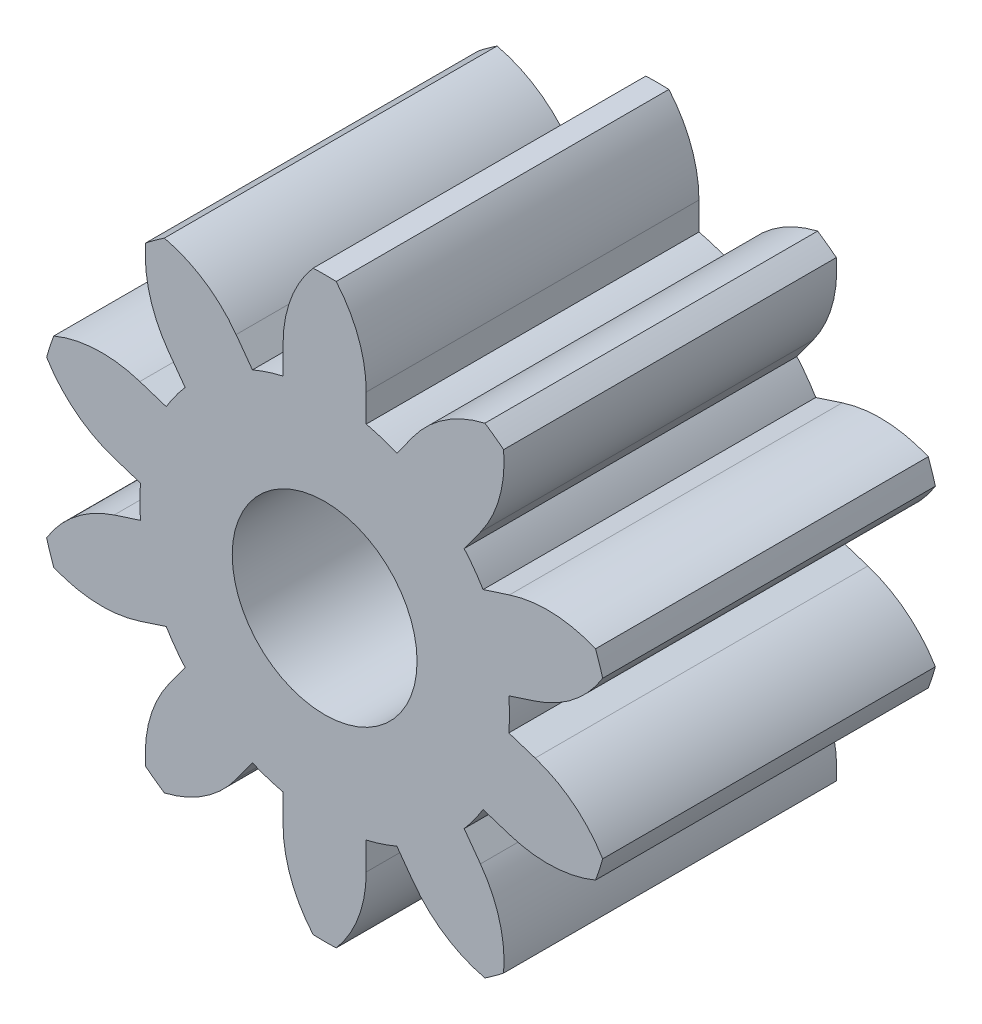
from build123d import *

# Parameters (mm, degrees)
ESBO_O1_R                = 2
RESSALTO_EXTRUS_O1_DEPTH = 3.6
CORTE_EXTRUS_O1_REACH    = 7.637
ESBO_O2_R                = 1


with BuildPart() as part:
    # Esboço1 → Ressalto-extrusão1 (new body)
    with BuildSketch(Plane.XY):
        Circle(ESBO_O1_R)
        with BuildLine():
            Line((-1.99959981, -1.122867364), (-1.714282855, -1.030162265))
            ThreePointArc((-1.714282855, -1.030162265), (-1.902113033, -0.618033989), (-1.99239815, -0.174211401))
            Line((-1.99239815, -0.174211401), (-2.277715105, -0.266916499))
            ThreePointArc((-2.277715105, -0.266916499), (-2.695113044, -0.490735084), (-3.008300145, -0.846023191))
            ThreePointArc((-3.008300145, -0.846023191), (-2.972051613, -0.965678107), (-2.931045896, -1.08378732))
            ThreePointArc((-2.931045896, -1.08378732), (-2.4688391, -1.187134677), (-1.99959981, -1.122867364))
        make_face()
        with BuildLine():
            Line((-2.277715105, 0.266916499), (-1.99239815, 0.174211401))
            ThreePointArc((-1.99239815, 0.174211401), (-1.902113033, 0.618033989), (-1.714282855, 1.030162265))
            Line((-1.714282855, 1.030162265), (-1.99959981, 1.122867364))
            ThreePointArc((-1.99959981, 1.122867364), (-2.4688391, 1.187134677), (-2.931045896, 1.08378732))
            ThreePointArc((-2.931045896, 1.08378732), (-2.972051613, 0.965678107), (-3.008300145, 0.846023191))
            ThreePointArc((-3.008300145, 0.846023191), (-2.695113044, 0.490735084), (-2.277715105, 0.266916499))
        make_face()
        with BuildLine():
            Line((-1.685820646, 1.554747331), (-1.509485071, 1.312042233))
            ThreePointArc((-1.509485071, 1.312042233), (-1.175570505, 1.618033989), (-0.781369776, 1.84104896))
            Line((-0.781369776, 1.84104896), (-0.957705351, 2.083754058))
            ThreePointArc((-0.957705351, 2.083754058), (-1.299552532, 2.411559342), (-1.734231738, 2.599627912))
            ThreePointArc((-1.734231738, 2.599627912), (-1.836828913, 2.528178107), (-1.936485986, 2.452681599))
            ThreePointArc((-1.936485986, 2.452681599), (-1.891945409, 1.981160724), (-1.685820646, 1.554747331))
        make_face()
        with BuildLine():
            Line((-0.45, 2.248717527), (-0.45, 1.948717527))
            ThreePointArc((-0.45, 1.948717527), (0, 2), (0.45, 1.948717527))
            Line((0.45, 1.948717527), (0.45, 2.248717527))
            ThreePointArc((0.45, 2.248717527), (0.366118933, 2.714850303), (0.125, 3.122498999))
            ThreePointArc((0.125, 3.122498999), (0, 3.125), (-0.125, 3.122498999))
            ThreePointArc((-0.125, 3.122498999), (-0.366118933, 2.714850303), (-0.45, 2.248717527))
        make_face()
        with BuildLine():
            ThreePointArc((0.781369776, 1.84104896), (1.175570505, 1.618033989), (1.509485071, 1.312042233))
            Line((1.509485071, 1.312042233), (1.685820646, 1.554747331))
            ThreePointArc((1.685820646, 1.554747331), (1.891945409, 1.981160724), (1.936485986, 2.452681599))
            ThreePointArc((1.936485986, 2.452681599), (1.836828913, 2.528178107), (1.734231738, 2.599627912))
            ThreePointArc((1.734231738, 2.599627912), (1.299552532, 2.411559342), (0.957705351, 2.083754058))
            Line((0.957705351, 2.083754058), (0.781369776, 1.84104896))
        make_face()
        with BuildLine():
            ThreePointArc((1.714282855, 1.030162265), (1.902113033, 0.618033989), (1.99239815, 0.174211401))
            Line((1.99239815, 0.174211401), (2.277715105, 0.266916499))
            ThreePointArc((2.277715105, 0.266916499), (2.695113044, 0.490735084), (3.008300145, 0.846023191))
            ThreePointArc((3.008300145, 0.846023191), (2.972051613, 0.965678107), (2.931045896, 1.08378732))
            ThreePointArc((2.931045896, 1.08378732), (2.4688391, 1.187134677), (1.99959981, 1.122867364))
            Line((1.99959981, 1.122867364), (1.714282855, 1.030162265))
        make_face()
        with BuildLine():
            ThreePointArc((1.99239815, -0.174211401), (1.902113033, -0.618033989), (1.714282855, -1.030162265))
            Line((1.714282855, -1.030162265), (1.99959981, -1.122867364))
            ThreePointArc((1.99959981, -1.122867364), (2.4688391, -1.187134677), (2.931045896, -1.08378732))
            ThreePointArc((2.931045896, -1.08378732), (2.972051613, -0.965678107), (3.008300145, -0.846023191))
            ThreePointArc((3.008300145, -0.846023191), (2.695113044, -0.490735084), (2.277715105, -0.266916499))
            Line((2.277715105, -0.266916499), (1.99239815, -0.174211401))
        make_face()
        with BuildLine():
            ThreePointArc((1.509485071, -1.312042233), (1.175570505, -1.618033989), (0.781369776, -1.84104896))
            Line((0.781369776, -1.84104896), (0.957705351, -2.083754058))
            ThreePointArc((0.957705351, -2.083754058), (1.299552532, -2.411559342), (1.734231738, -2.599627912))
            ThreePointArc((1.734231738, -2.599627912), (1.836828913, -2.528178107), (1.936485986, -2.452681599))
            ThreePointArc((1.936485986, -2.452681599), (1.891945409, -1.981160724), (1.685820646, -1.554747331))
            Line((1.685820646, -1.554747331), (1.509485071, -1.312042233))
        make_face()
        with BuildLine():
            Line((-0.45, -1.948717527), (-0.45, -2.248717527))
            ThreePointArc((-0.45, -2.248717527), (-0.366118933, -2.714850303), (-0.125, -3.122498999))
            ThreePointArc((-0.125, -3.122498999), (0, -3.125), (0.125, -3.122498999))
            ThreePointArc((0.125, -3.122498999), (0.366118933, -2.714850303), (0.45, -2.248717527))
            Line((0.45, -2.248717527), (0.45, -1.948717527))
            ThreePointArc((0.45, -1.948717527), (0, -2), (-0.45, -1.948717527))
        make_face()
        with BuildLine():
            Line((-0.957705351, -2.083754058), (-0.781369776, -1.84104896))
            ThreePointArc((-0.781369776, -1.84104896), (-1.175570505, -1.618033989), (-1.509485071, -1.312042233))
            Line((-1.509485071, -1.312042233), (-1.685820646, -1.554747331))
            ThreePointArc((-1.685820646, -1.554747331), (-1.891945409, -1.981160724), (-1.936485986, -2.452681599))
            ThreePointArc((-1.936485986, -2.452681599), (-1.836828913, -2.528178107), (-1.734231738, -2.599627912))
            ThreePointArc((-1.734231738, -2.599627912), (-1.299552532, -2.411559342), (-0.957705351, -2.083754058))
        make_face()
    extrude(amount=RESSALTO_EXTRUS_O1_DEPTH)

    # Esboço2 → Corte-extrusão1 (cut, up to next)
    with BuildSketch(Plane.XY.offset(3.6), mode=Mode.PRIVATE) as corte_extrus_o1_sk1:
        Circle(ESBO_O2_R)
    corte_extrus_o1_tool1 = extrude(corte_extrus_o1_sk1.sketch, amount=-CORTE_EXTRUS_O1_REACH, mode=Mode.PRIVATE) & part.part
    add(corte_extrus_o1_tool1.solids().sort_by_distance((0, 0, 3.6))[0], mode=Mode.SUBTRACT)


solid = part.part
